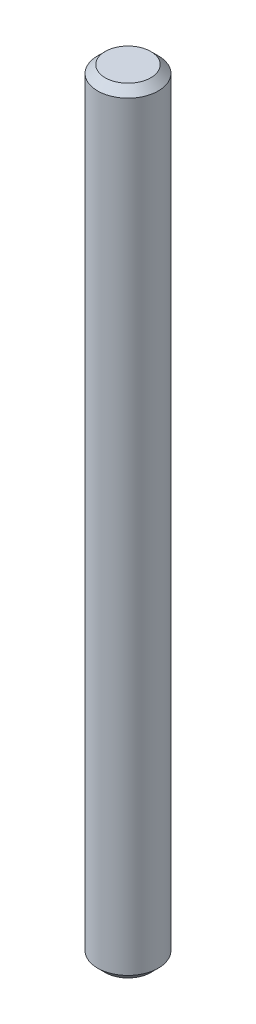
from build123d import *

# Parameters (mm, degrees)
SKETCH_1_R      = 2
EXTRUDE_1_DEPTH = 51
CHAMFER_1_SIZE  = 0.5


with BuildPart() as part:
    # 草图1 → 凸台-拉伸1 (new body)
    with BuildSketch(Plane(origin=(0, 0, 0), x_dir=(1, 0, 0), z_dir=(0, 1, 0))):
        with Locations(Location((0.567374904, 0.593248779, 0), (0, 0, 270))):
            Circle(SKETCH_1_R)
    extrude(amount=EXTRUDE_1_DEPTH)

    # 倒角1
    chamfer_1_edges = [part.edges().sort_by_distance(p)[0] for p in [
        (0.567374904, 0, -2.593248779),
        (0.567374904, 51, -2.593248779),
    ]]
    chamfer(chamfer_1_edges, length=CHAMFER_1_SIZE)


solid = part.part
